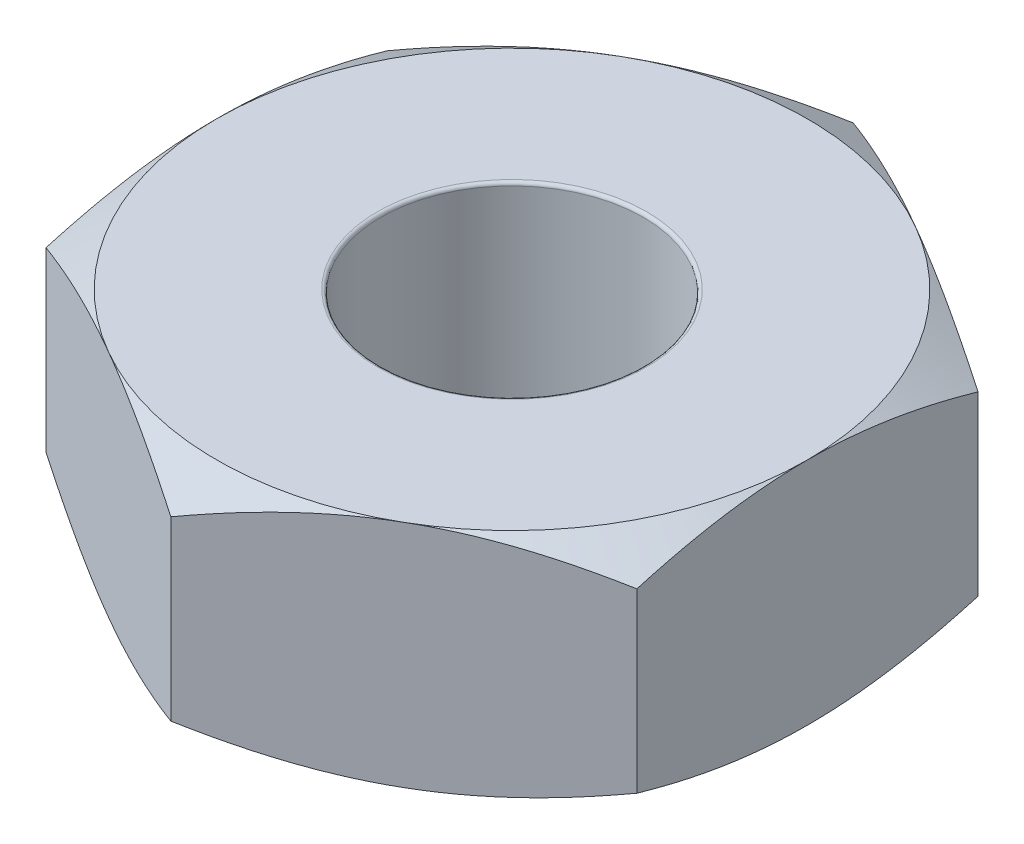
from build123d import *

# Parameters (mm, degrees)
SKETCH1_R           = 1
BOSS_EXTRUDE1_DEPTH = 1.75
SKETCH2_OUTSIDE_W   = 13.98
SKETCH2_OUTSIDE_H   = 14.676
SKETCH2_OUTSIDE_R   = 2.25
CUT_EXTRUDE1_DEPTH  = 1.75
CUT_EXTRUDE1_DRAFT  = -60
SKETCH3_OUTSIDE_W   = 13.98
SKETCH3_OUTSIDE_H   = 14.676
SKETCH3_OUTSIDE_R   = 2.25
CUT_EXTRUDE2_DEPTH  = 1.75
CUT_EXTRUDE2_DRAFT  = -60
FILLET1_R           = 0.025


with BuildPart() as part:
    # Sketch1 → Boss-Extrude1 (new body)
    with BuildSketch(Plane(origin=(0, 0, 0), x_dir=(1, 0, 0), z_dir=(0, 1, 0))):
        Polygon((0, -2.598076211), (2.25, -1.299038106), (2.25, 1.299038106), (0, 2.598076211), (-2.25, 1.299038106), (-2.25, -1.299038106), align=None)
        with Locations(Location((0, 0, 0), (0, 0, 270))):
            Circle(SKETCH1_R, mode=Mode.SUBTRACT)
    extrude(amount=BOSS_EXTRUDE1_DEPTH)


with BuildPart() as cut_extrude1_tool:
    # Sketch2 outside → Cut-Extrude1 (with draft: the straight prism first)
    with BuildSketch(Plane(origin=(0, 1.75, 0), x_dir=(1, 0, 0), z_dir=(0, 1, 0))):
        Rectangle(SKETCH2_OUTSIDE_W, SKETCH2_OUTSIDE_H)
        Circle(SKETCH2_OUTSIDE_R, mode=Mode.SUBTRACT)
    extrude(amount=-CUT_EXTRUDE1_DEPTH)
    # Cut-Extrude1: the draft: its side faces are tilted about the plane it starts from
    cut_extrude1_sides = [cut_extrude1_tool.faces().sort_by_distance(p)[0] for p in [
        (0, 0.875, 7.338),
        (6.99, 0.875, 0),
        (0, 0.875, -7.338),
        (-6.99, 0.875, 0),
        (-2.25, 0.875, 0),
    ]]
    draft(cut_extrude1_sides, Plane(origin=(0, 1.75, 0), x_dir=(1, 0, 0), z_dir=(0, 1, 0)), CUT_EXTRUDE1_DRAFT)


with BuildPart() as part_1:
    add(part.part)

    # Cut-Extrude1: cut by cut_extrude1_tool
    add(cut_extrude1_tool.part, mode=Mode.SUBTRACT)


with BuildPart() as cut_extrude2_tool:
    # Sketch3 outside → Cut-Extrude2 (with draft: the straight prism first)
    with BuildSketch(Plane.XZ):
        Rectangle(SKETCH3_OUTSIDE_W, SKETCH3_OUTSIDE_H)
        Circle(SKETCH3_OUTSIDE_R, mode=Mode.SUBTRACT)
    extrude(amount=-CUT_EXTRUDE2_DEPTH)
    # Cut-Extrude2: the draft: its side faces are tilted about the plane it starts from
    cut_extrude2_sides = [cut_extrude2_tool.faces().sort_by_distance(p)[0] for p in [
        (0, 0.875, -7.338),
        (6.99, 0.875, 0),
        (0, 0.875, 7.338),
        (-6.99, 0.875, 0),
        (-2.25, 0.875, 0),
    ]]
    draft(cut_extrude2_sides, Plane.XZ, CUT_EXTRUDE2_DRAFT)


with BuildPart() as part_2:
    add(part_1.part)

    # Cut-Extrude2: cut by cut_extrude2_tool
    add(cut_extrude2_tool.part, mode=Mode.SUBTRACT)

    # Fillet1
    fillet1_edges = [part_2.edges().sort_by_distance(p)[0] for p in [
        (0, 0, -1),
        (0, 1.75, -1),
    ]]
    fillet(fillet1_edges, radius=FILLET1_R)


solid = part_2.part
